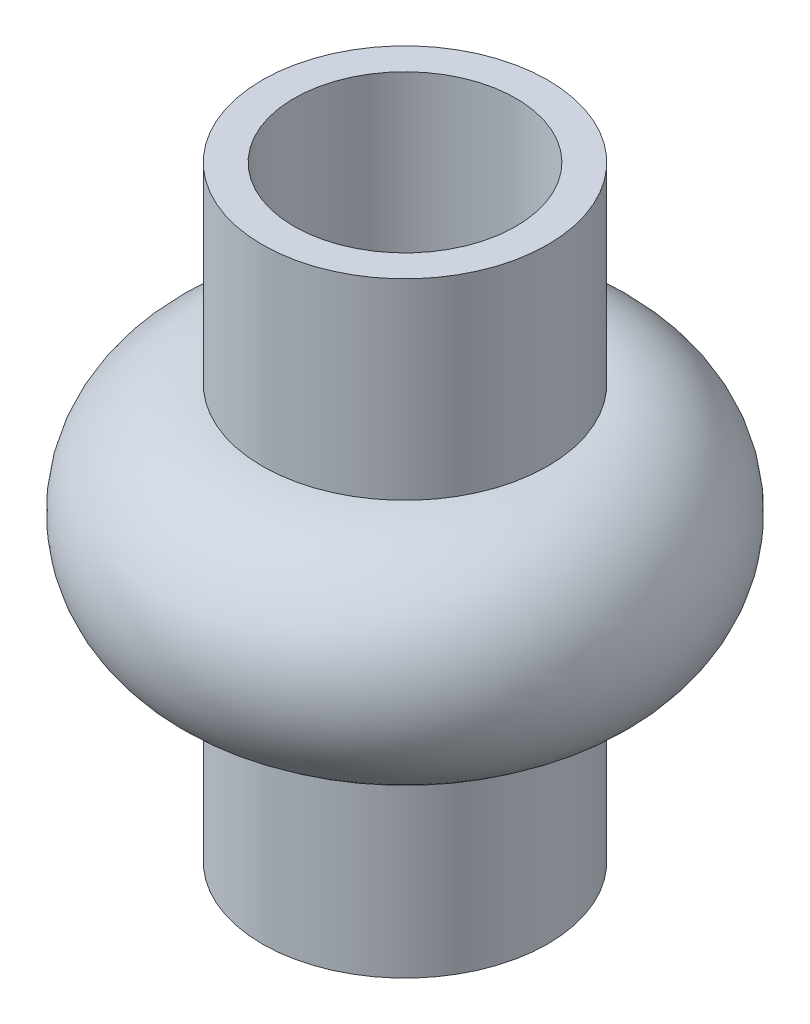
from build123d import *


with BuildPart() as part:
    # Sketch1 → Revolve1 (revolve)
    with BuildSketch(Plane.XY, mode=Mode.PRIVATE) as revolve1_sk:
        with BuildLine():
            Line((-9, -19.1), (-7, -19.1))
            Line((-7, -19.1), (-7, -7))
            add(Edge.make_bspline(
                [(-7, 7), (-7, 5.328929103), (-12.699804955, 5.99068616), (-14.713166348, -0.022598793), (-12.699804955, -5.908285079), (-7, -5.464582725), (-7, -7)],
                knots=[0, 0, 0, 0, 0.225746399, 0.5, 0.774253601, 1, 1, 1, 1], degree=3))
            Line((-7, 7), (-7, 19.1))
            Line((-7, 19.1), (-9, 19.1))
            Line((-9, 19.1), (-9, 7))
            ThreePointArc((-9, 7), (-16, 0), (-9, -7))
            Line((-9, -7), (-9, -19.1))
        make_face()
    revolve(revolve1_sk.sketch.rotate(Axis((0, 18.462653929, 0), (0, -1, 0)), 270), axis=Axis((0, 18.462653929, 0), (0, -1, 0)))


solid = part.part
